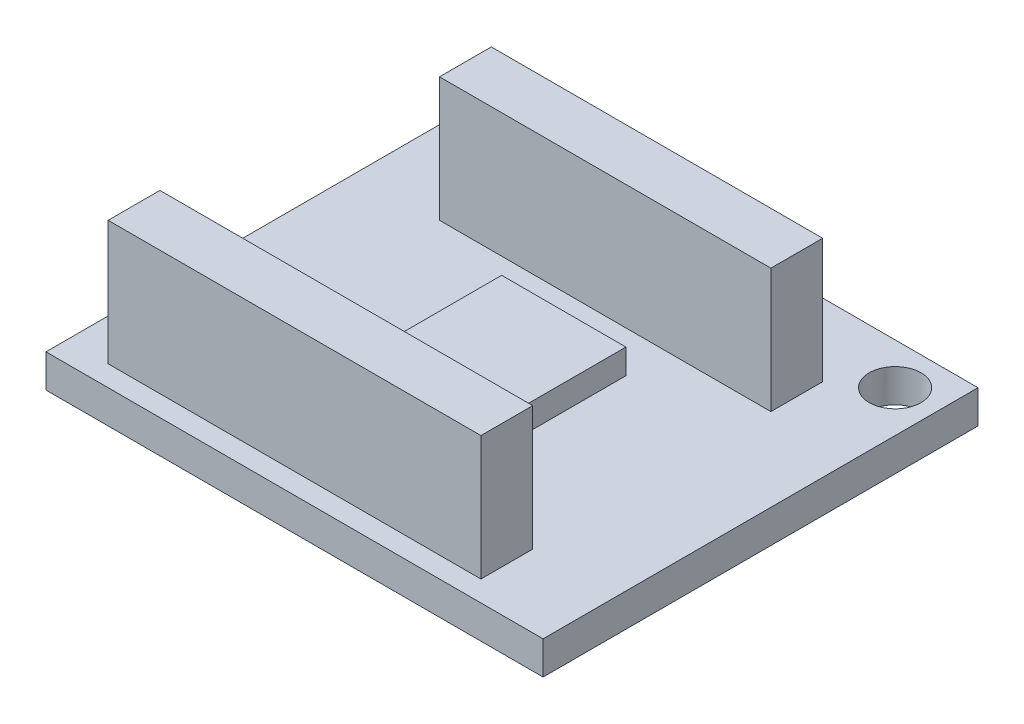
from build123d import *

# Parameters (mm, degrees)
SKETCH1_W               = 24
SKETCH1_H               = 21
PCB_DEPTH               = 1.6
MOUNT_HOLE_1_DEPTH      = 32.930549635
MOUNT_HOLE_1_DEPTH_BACK = 32.930549635
SKETCH2_R               = 1.25
MOUNT_HOLE_2_DEPTH      = 32.930549635
MOUNT_HOLE_2_DEPTH_BACK = 32.930549635
SKETCH3_R               = 1.25
MX1508_IC_START         = 1.6
SKETCH4_W               = 6
SKETCH4_H               = 5
MX1508_IC_DEPTH         = 1.2
PINS_IN_START           = 1.6
SKETCH5_W               = 18
SKETCH5_H               = 2.5
PINS_IN_DEPTH           = 6
PINS_OUT_START          = 1.6
SKETCH6_W               = 16
SKETCH6_H               = 2.5
PINS_OUT_DEPTH          = 6


with BuildPart() as part:
    # Sketch1 → PCB (new body)
    with BuildSketch(Plane(origin=(0, 0, 0), x_dir=(1, 0, 0), z_dir=(0, 1, 0))):
        with Locations((12, 10.5)):
            Rectangle(SKETCH1_W, SKETCH1_H)
    extrude(amount=PCB_DEPTH)

    # Sketch2 → Mount_hole_1 (cut, two sides: drawn at the far end of the back side and taken through both)
    with BuildSketch(Plane(origin=(0, 0, 0), x_dir=(1, 0, 0), z_dir=(0, 1, 0)).offset(-MOUNT_HOLE_1_DEPTH_BACK)):
        with Locations(Location((2, 19, 0), (0, 0, 270))):
            Circle(SKETCH2_R)
    extrude(amount=MOUNT_HOLE_1_DEPTH + MOUNT_HOLE_1_DEPTH_BACK, mode=Mode.SUBTRACT)

    # Sketch3 → Mount_hole_2 (cut, two sides: drawn at the far end of the back side and taken through both)
    with BuildSketch(Plane(origin=(0, 0, 0), x_dir=(1, 0, 0), z_dir=(0, 1, 0)).offset(-MOUNT_HOLE_2_DEPTH_BACK)):
        with Locations(Location((22, 19, 0), (0, 0, 270))):
            Circle(SKETCH3_R)
    extrude(amount=MOUNT_HOLE_2_DEPTH + MOUNT_HOLE_2_DEPTH_BACK, mode=Mode.SUBTRACT)

    # Sketch4 → MX1508_IC (add)
    with BuildSketch(Plane(origin=(0, 0, 0), x_dir=(1, 0, 0), z_dir=(0, 1, 0)).offset(MX1508_IC_START)):
        with Locations((12, 10.5)):
            Rectangle(SKETCH4_W, SKETCH4_H)
    extrude(amount=MX1508_IC_DEPTH)

    # Sketch5 → Pins_in (add)
    with BuildSketch(Plane(origin=(0, 0, 0), x_dir=(1, 0, 0), z_dir=(0, 1, 0)).offset(PINS_IN_START)):
        with Locations((11, 2.25)):
            Rectangle(SKETCH5_W, SKETCH5_H)
    extrude(amount=PINS_IN_DEPTH)

    # Sketch6 → Pins_out (add)
    with BuildSketch(Plane(origin=(0, 0, 0), x_dir=(1, 0, 0), z_dir=(0, 1, 0)).offset(PINS_OUT_START)):
        with Locations((12, 16.25)):
            Rectangle(SKETCH6_W, SKETCH6_H)
    extrude(amount=PINS_OUT_DEPTH)


solid = part.part
